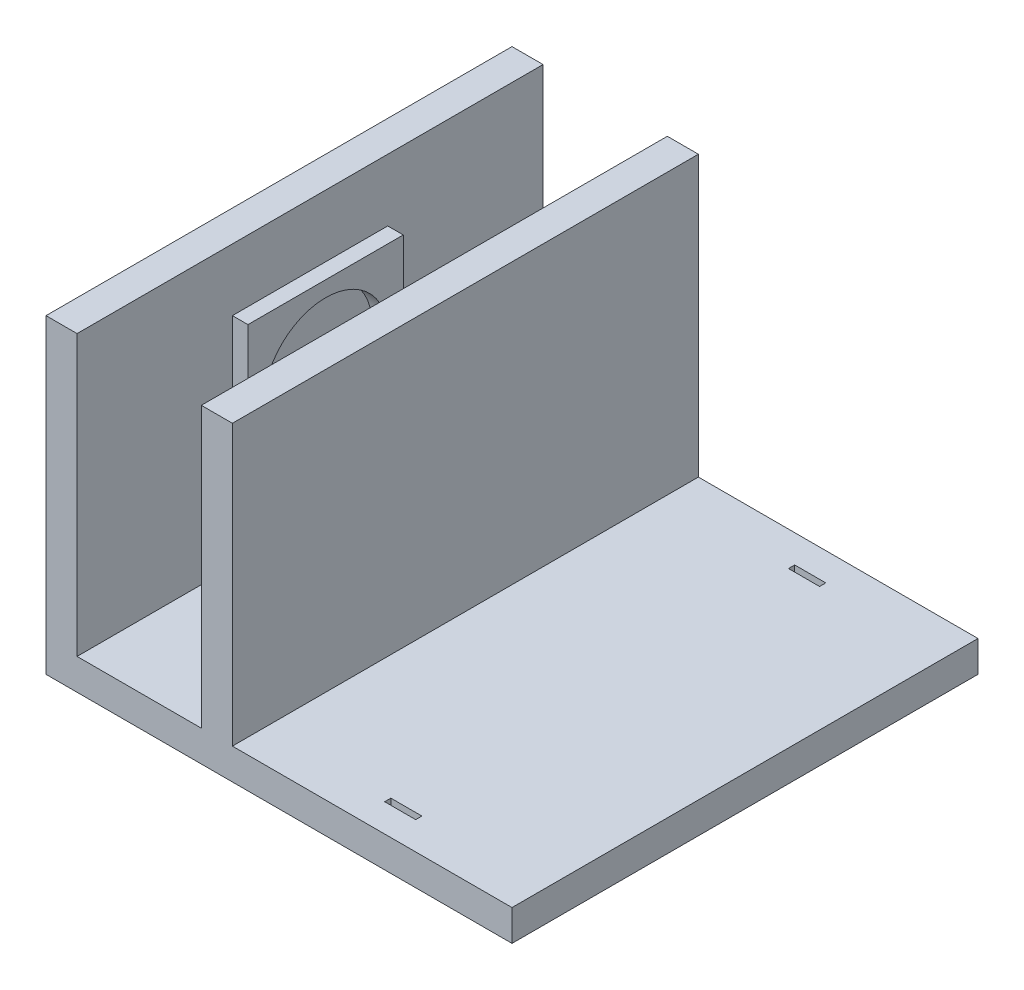
from build123d import *

# Parameters (mm, degrees)
BOSS_EXTRUDE1_DEPTH = 150
SKETCH3_W           = 10
SKETCH3_H           = 2
CUT_EXTRUDE1_DEPTH  = 10
SKETCH4_W           = 50
SKETCH4_H           = 50
SKETCH4_R           = 20
BOSS_EXTRUDE2_DEPTH = 5
BOSS_EXTRUDE3_START = 5
SKETCH5_W           = 50
SKETCH5_H           = 50
SKETCH5_R           = 20
BOSS_EXTRUDE3_DEPTH = 5
SKETCH6_R           = 1.5
CUT_EXTRUDE2_DEPTH  = 229.25424421


with BuildPart() as part:
    # Sketch1 → Boss-Extrude1 (new body)
    with BuildSketch(Plane.XY):
        Polygon((50, 100), (50, 10), (10, 10), (10, 100), (0, 100), (0, 10), (0, 0), (10, 0), (150, 0), (150, 10), (60, 10), (60, 100), align=None)
    extrude(amount=BOSS_EXTRUDE1_DEPTH)

    # Sketch3 → Cut-Extrude1 (cut)
    with BuildSketch(Plane(origin=(0, 10, 0), x_dir=(1, 0, 0), z_dir=(0, 1, 0))):
        with Locations((105, -10)):
            Rectangle(SKETCH3_W, SKETCH3_H)
        with Locations((105, -140)):
            Rectangle(SKETCH3_W, SKETCH3_H)
    extrude(amount=-CUT_EXTRUDE1_DEPTH, mode=Mode.SUBTRACT)

    # Sketch4 → Boss-Extrude2 (add)
    with BuildSketch(Plane(origin=(10, 0, 0), x_dir=(0, 0, -1), z_dir=(1, 0, 0))):
        with Locations((-75, 55)):
            Rectangle(SKETCH4_W, SKETCH4_H)
        with Locations((-75, 55)):
            Circle(SKETCH4_R, mode=Mode.SUBTRACT)
    extrude(amount=BOSS_EXTRUDE2_DEPTH)

    # Sketch5 → Boss-Extrude3 (add)
    with BuildSketch(Plane.ZY.offset(-50).offset(BOSS_EXTRUDE3_START)):
        with Locations((75, 55)):
            Rectangle(SKETCH5_W, SKETCH5_H)
        with Locations(Location((75, 55, 0), (0, 0, 180))):
            Circle(SKETCH5_R, mode=Mode.SUBTRACT)
    extrude(amount=-BOSS_EXTRUDE3_DEPTH)

    # Sketch6 → Cut-Extrude2 (cut, through all)
    with BuildSketch(Plane(origin=(10, 0, 0), x_dir=(0, 0, -1), z_dir=(1, 0, 0))):
        with Locations((-75, 55)):
            Circle(SKETCH6_R)
    extrude(amount=-CUT_EXTRUDE2_DEPTH, mode=Mode.SUBTRACT)


solid = part.part
